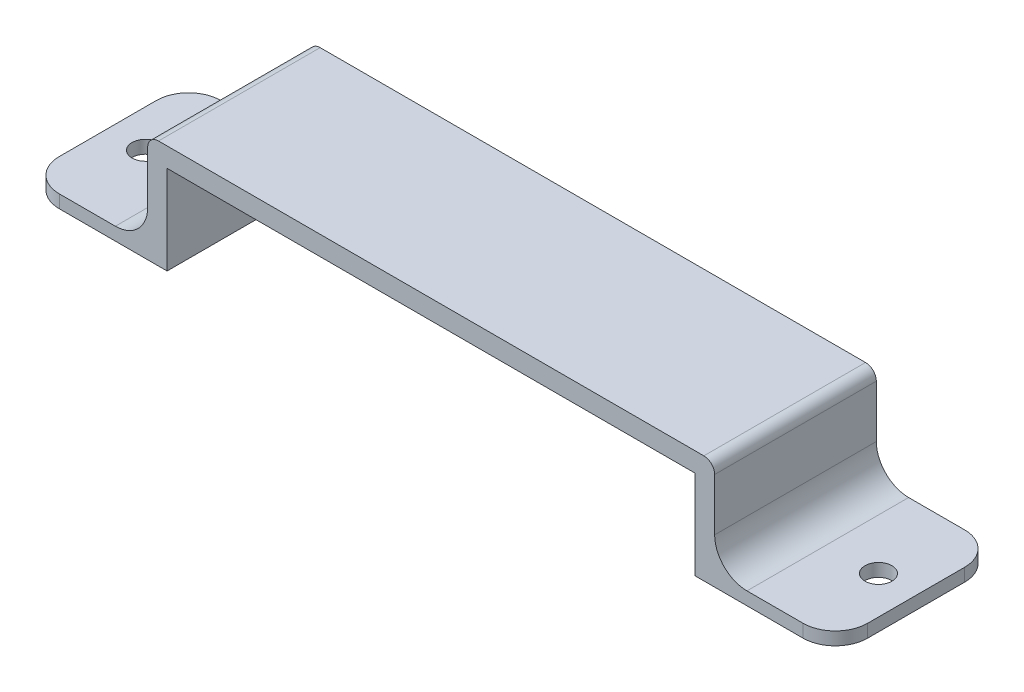
from build123d import *

# Parameters (mm, degrees)
BOSS_EXTRUDE1_DEPTH = 15
CUT_EXTRUDE1_REACH  = 57.908
SKETCH2_R           = 1.25
FILLET1_R           = 3
FILLET2_R           = 1


with BuildPart() as part:
    # Sketch1 → Boss-Extrude1 (new body)
    with BuildSketch(Plane.XY):
        Polygon((-21.874229857, 0), (-8.874229857, 0), (-8.874229857, 8.25), (40.125770143, 8.25), (40.125770143, 0), (53.125770143, 0), (53.125770143, 1.2), (41.925770143, 1.2), (41.925770143, 10.05), (-10.674229857, 10.05), (-10.674229857, 1.2), (-21.874229857, 1.2), align=None)
    extrude(amount=BOSS_EXTRUDE1_DEPTH)

    # Sketch2 → Cut-Extrude1 (cut, up to next)
    with BuildSketch(Plane(origin=(0, 1.2, 0), x_dir=(1, 0, 0), z_dir=(0, 1, 0)), mode=Mode.PRIVATE) as cut_extrude1_sk1:
        with Locations(Location((-18.374229857, -7.5, 0), (0, 0, 180))):
            Circle(SKETCH2_R)
    cut_extrude1_tool1 = extrude(cut_extrude1_sk1.sketch, amount=-CUT_EXTRUDE1_REACH, mode=Mode.PRIVATE) & part.part
    # Sketch2 → Cut-Extrude1 (cut, up to next)
    with BuildSketch(Plane(origin=(0, 1.2, 0), x_dir=(1, 0, 0), z_dir=(0, 1, 0)), mode=Mode.PRIVATE) as cut_extrude1_sk2:
        with Locations(Location((49.625770143, -7.5, 0), (0, 0, 180))):
            Circle(SKETCH2_R)
    cut_extrude1_tool2 = extrude(cut_extrude1_sk2.sketch, amount=-CUT_EXTRUDE1_REACH, mode=Mode.PRIVATE) & part.part
    add(cut_extrude1_tool1.solids().sort_by_distance((-18.37423, 1.2, 7.5))[0], mode=Mode.SUBTRACT)
    add(cut_extrude1_tool2.solids().sort_by_distance((49.62577, 1.2, 7.5))[0], mode=Mode.SUBTRACT)

    # Fillet1
    fillet1_edges = [part.edges().sort_by_distance(p)[0] for p in [
        (53.125770143, 0.6, 0),
        (-21.874229857, 0.6, 0),
        (-10.674229857, 1.2, 7.5),
        (41.925770143, 1.2, 7.5),
        (53.125770143, 0.6, 15),
        (-21.874229857, 0.6, 15),
    ]]
    fillet(fillet1_edges, radius=FILLET1_R)

    # Fillet2
    fillet2_edges = [part.edges().sort_by_distance(p)[0] for p in [
        (-10.674229857, 10.05, 7.5),
        (41.925770143, 10.05, 7.5),
    ]]
    fillet(fillet2_edges, radius=FILLET2_R)


solid = part.part
